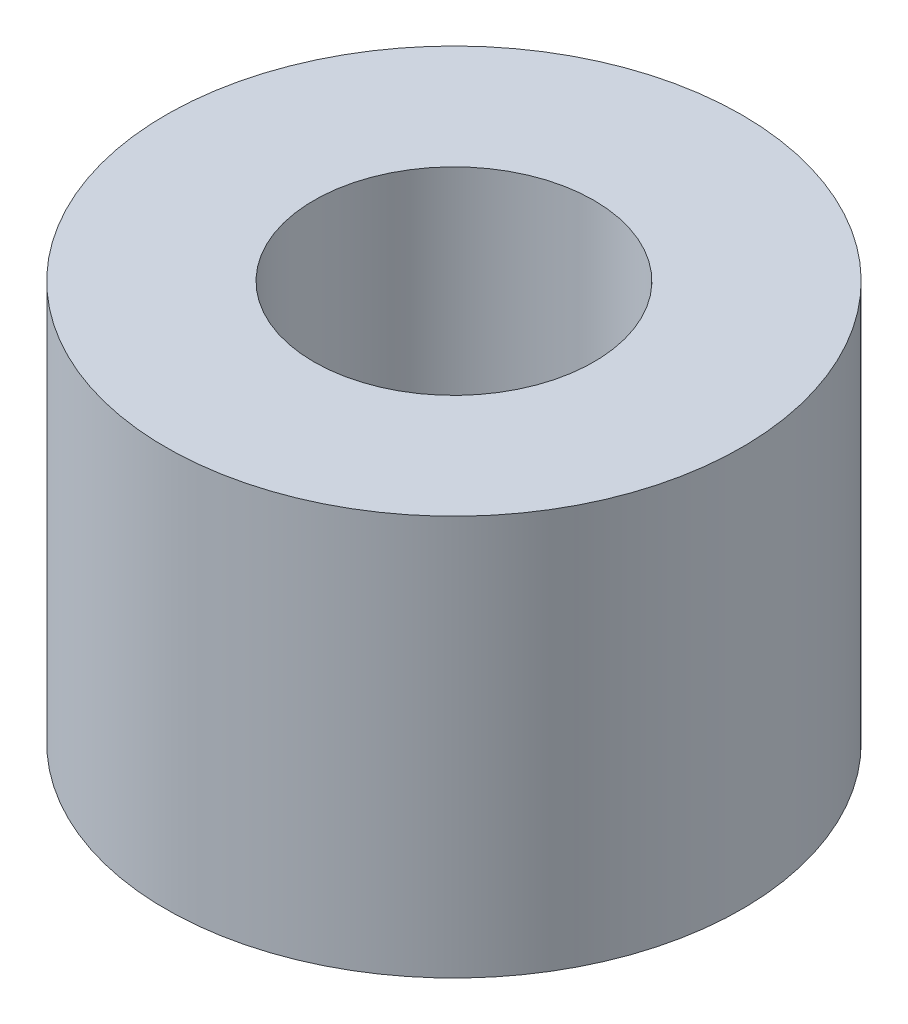
from build123d import *

# Parameters (mm, degrees)
SKETCH1_R        = 4.572
SKETCH1_R_2      = 2.2225
EXTRUSION1_DEPTH = 6.35


with BuildPart() as part:
    # Sketch1 → Extrusion1 (new body)
    with BuildSketch(Plane(origin=(0, 0, 0), x_dir=(-1, 0, 0), z_dir=(0, 1, 0))):
        with Locations(Location((0, 0, 0), (0, 0, 270))):
            Circle(SKETCH1_R)
        with Locations(Location((0, 0, 0), (0, 0, 270))):
            Circle(SKETCH1_R_2, mode=Mode.SUBTRACT)
    extrude(amount=EXTRUSION1_DEPTH)


solid = part.part
